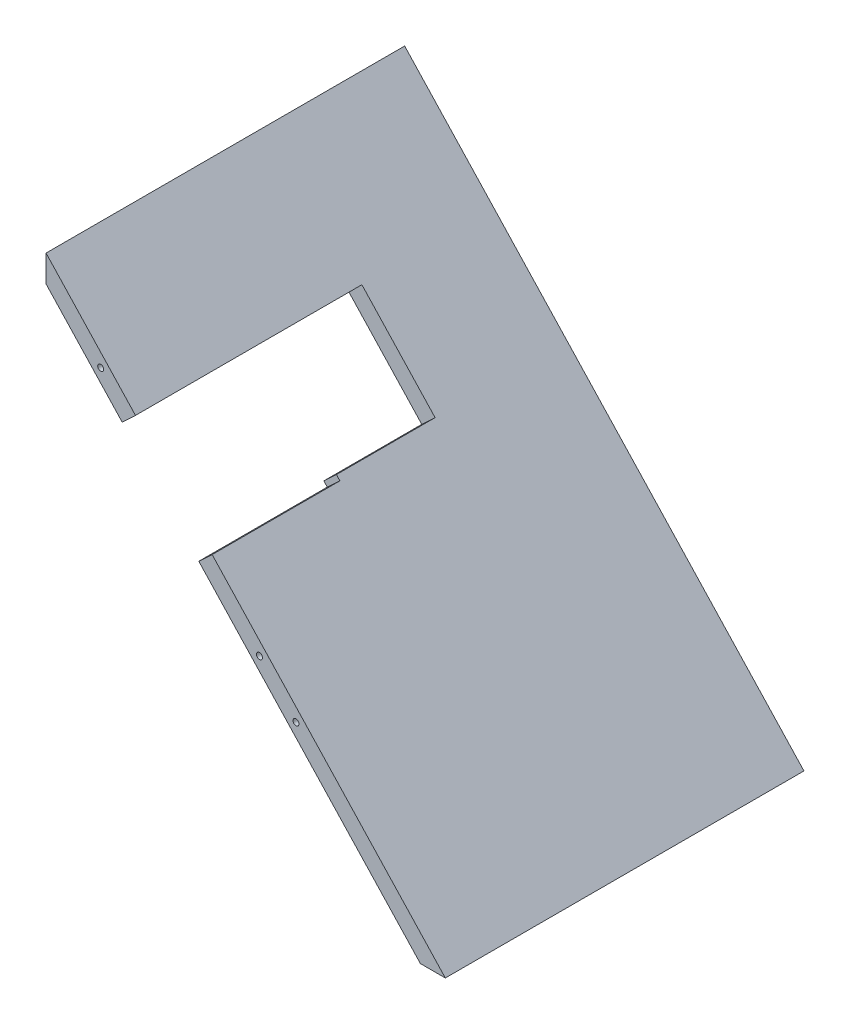
from build123d import *

# Parameters (mm, degrees)
BOSS_EXTRUDE1_DEPTH = 170.18
SKETCH2_W           = 107.442
SKETCH2_H           = 53.34
CUT_EXTRUDE1_DEPTH  = 170.18
SKETCH3_W           = 46.821602836
SKETCH3_H           = 2.401895457
BOSS_EXTRUDE2_DEPTH = 8.1534
SKETCH4_R           = 1.4224
CUT_EXTRUDE2_DEPTH  = 10.16


with BuildPart() as part:
    # Sketch1 → Boss-Extrude1 (new body)
    with BuildSketch(Plane.XY):
        Polygon((189.487065503, 0), (177.644123909, 0), (0, 190.5), (0, 203.2), align=None)
    extrude(amount=BOSS_EXTRUDE1_DEPTH)

    # Sketch2 → Cut-Extrude1 (cut)
    with BuildSketch(Plane(origin=(101.352507506, 94.512742268, 0), x_dir=(0, 0, -1), z_dir=(0.7313537016191667, 0.6819983600625027, 0))):
        with Locations((-116.459, 59.711072169)):
            Rectangle(SKETCH2_W, SKETCH2_H)
    extrude(amount=-CUT_EXTRUDE1_DEPTH, mode=Mode.SUBTRACT)

    # Sketch3 → Boss-Extrude2 (add)
    with BuildSketch(Plane(origin=(101.352507506, 94.512742268, 0), x_dir=(0, 0, -1), z_dir=(0.7313537016191667, 0.6819983600625027, 0))):
        with Locations((-86.148801418, 34.242019898)):
            Rectangle(SKETCH3_W, SKETCH3_H)
    extrude(amount=-BOSS_EXTRUDE2_DEPTH)

    # Sketch4 → Cut-Extrude2 (cut)
    with BuildSketch(Plane.XY.offset(170.18)):
        with Locations((25.928493761, 169.045094592)):
            Circle(SKETCH4_R)
        with Locations((101.282492565, 88.2378241)):
            Circle(SKETCH4_R)
        with Locations((118.60525091, 69.661440079)):
            Circle(SKETCH4_R)
    cut_extrude2 = extrude(amount=-CUT_EXTRUDE2_DEPTH, mode=Mode.SUBTRACT)

    # Mirror1: Cut-Extrude2 across plane
    add(cut_extrude2.mirror(Plane.XY.offset(85.09)), mode=Mode.SUBTRACT)


solid = part.part
